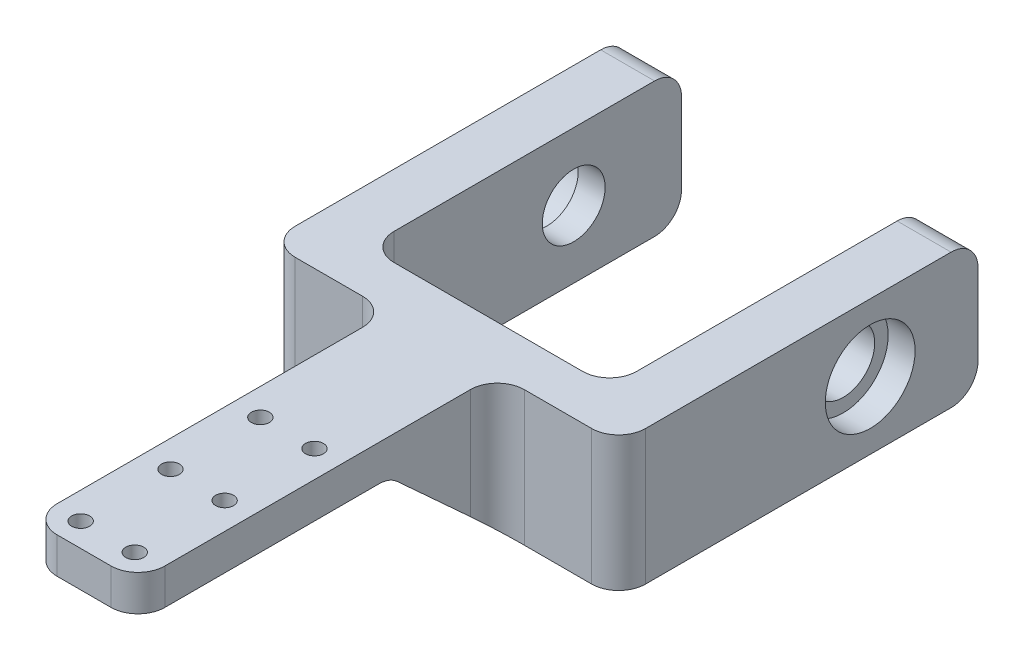
from build123d import *

# Parameters (mm, degrees)
BOSS_EXTRUDE1_DEPTH = 15
SKETCH3_R           = 5
CUT_EXTRUDE1_DEPTH  = 3
CUT_EXTRUDE2_START  = -3
SKETCH4_R           = 5
CUT_EXTRUDE2_DEPTH  = 3
SKETCH5_R           = 3.5
CUT_EXTRUDE3_DEPTH  = 64
CUT_EXTRUDE4_DEPTH  = 15
FILLET2_R           = 3
FILLET3_R           = 3
FILLET5_R           = 3
FILLET6_R           = 3
SKETCH7_R           = 1
CUT_EXTRUDE5_DEPTH  = 4


with BuildPart() as part:
    # Sketch2 → Boss-Extrude1 (new body)
    with BuildSketch(Plane(origin=(0, 0, 0), x_dir=(1, 0, 0), z_dir=(0, 1, 0))):
        Polygon((-6, -40), (6, -40), (6, 0), (19.5, 0), (19.5, 40), (13.5, 40), (13.5, 5), (-13.5, 5), (-13.5, 40), (-19.5, 40), (-19.5, 0), (-6, 0), align=None)
    extrude(amount=BOSS_EXTRUDE1_DEPTH)

    # Sketch3 → Cut-Extrude1 (cut)
    with BuildSketch(Plane(origin=(19.5, 0, 0), x_dir=(0, 0, -1), z_dir=(1, 0, 0))):
        with Locations((28, 7.5)):
            Circle(SKETCH3_R)
    extrude(amount=-CUT_EXTRUDE1_DEPTH, mode=Mode.SUBTRACT)

    # Sketch4 → Cut-Extrude2 (cut)
    with BuildSketch(Plane.ZY.offset(19.5).offset(CUT_EXTRUDE2_START)):
        with Locations(Location((-28, 7.5, 0), (0, 0, 180))):
            Circle(SKETCH4_R)
    extrude(amount=CUT_EXTRUDE2_DEPTH, mode=Mode.SUBTRACT)

    # Sketch5 → Cut-Extrude3 (cut)
    with BuildSketch(Plane(origin=(16.5, 0, 0), x_dir=(0, 0, -1), z_dir=(1, 0, 0))):
        with Locations(Location((28, 7.5, 0), (0, 0, 180))):
            Circle(SKETCH5_R)
    extrude(amount=-CUT_EXTRUDE3_DEPTH, mode=Mode.SUBTRACT)

    # Sketch6 → Cut-Extrude4 (cut)
    with BuildSketch(Plane.ZY.offset(6)):
        Polygon((40, 0), (40, 11), (12, 11), (0, 0), align=None)
    extrude(amount=-CUT_EXTRUDE4_DEPTH, mode=Mode.SUBTRACT)

    # Fillet2
    fillet2_edges = [part.edges().sort_by_distance(p)[0] for p in [
        (-16.5, 0, -40),
        (16.5, 0, -40),
        (16.5, 15, -40),
        (-16.5, 15, -40),
    ]]
    fillet(fillet2_edges, radius=FILLET2_R)

    # Fillet3
    fillet3_edges = [part.edges().sort_by_distance(p)[0] for p in [
        (-19.5, 7.5, 0),
        (-13.5, 7.5, -5),
        (13.5, 7.5, -5),
        (19.5, 7.5, 0),
    ]]
    fillet(fillet3_edges, radius=FILLET3_R)

    # Fillet5
    fillet5_edges = [part.edges().sort_by_distance(p)[0] for p in [
        (6, 7.5, 0),
        (-6, 7.5, 0),
        (0, 11, 12),
    ]]
    fillet(fillet5_edges, radius=FILLET5_R)

    # Fillet6
    fillet6_edges = [part.edges().sort_by_distance(p)[0] for p in [
        (6, 13, 40),
        (-6, 13, 40),
    ]]
    fillet(fillet6_edges, radius=FILLET6_R)

    # Sketch7 → Cut-Extrude5 (cut)
    with BuildSketch(Plane.XZ.offset(-11)):
        with Locations(Location((-3.010508875, 37.365518676, 0), (0, 0, 270))):
            Circle(SKETCH7_R)
        with Locations(Location((-3.010508875, 27.365518676, 0), (0, 0, 270))):
            Circle(SKETCH7_R)
        with Locations(Location((-3.010508875, 17.365518676, 0), (0, 0, 270))):
            Circle(SKETCH7_R)
        with Locations(Location((3.010508875, 17.365518676, 0), (0, 0, 90))):
            Circle(SKETCH7_R)
        with Locations(Location((3.010508875, 27.365518676, 0), (0, 0, 90))):
            Circle(SKETCH7_R)
        with Locations(Location((3.010508875, 37.365518676, 0), (0, 0, 90))):
            Circle(SKETCH7_R)
    extrude(amount=-CUT_EXTRUDE5_DEPTH, mode=Mode.SUBTRACT)


solid = part.part
